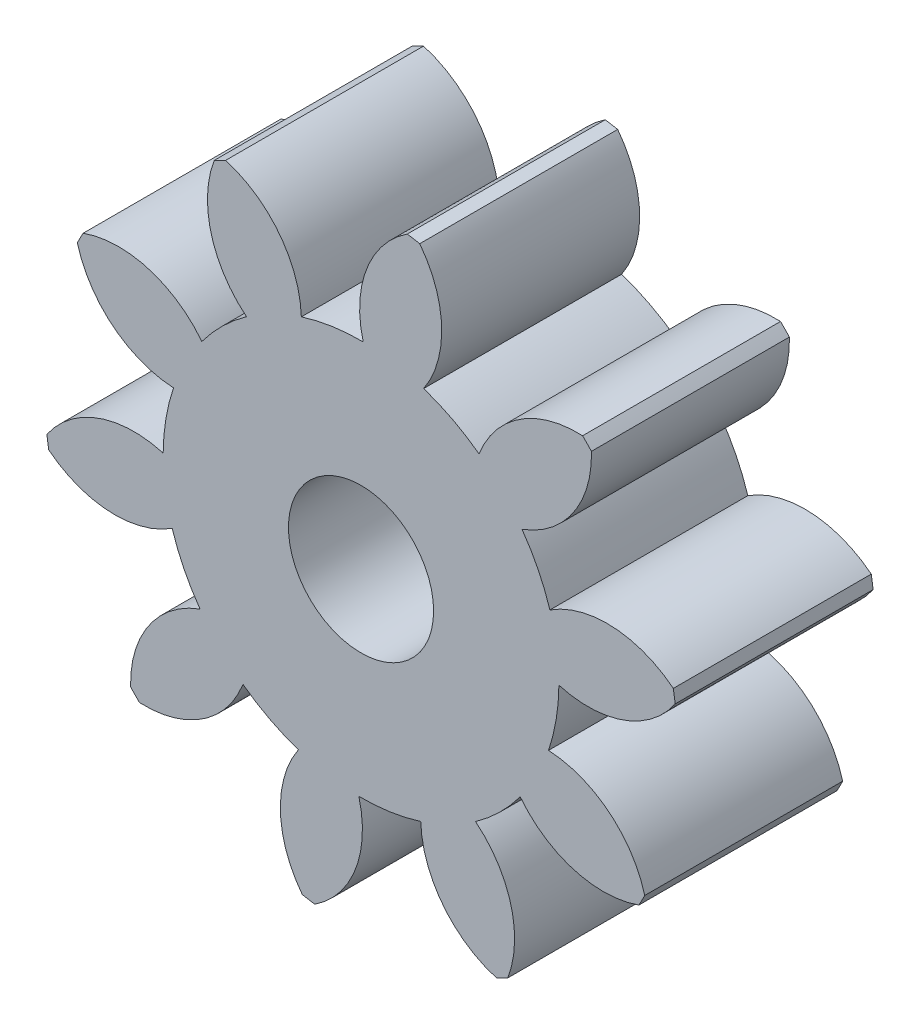
from build123d import *

# Parameters (mm, degrees)
SKETCH1_R           = 6
SKETCH1_R_2         = 1.1
BOSS_EXTRUDE1_DEPTH = 2.9
SKETCH2_R           = 6
CUT_EXTRUDE1_DEPTH  = 11.278132126
CUT_EXTRUDE2_DEPTH  = 2.8


with BuildPart() as part:
    # Sketch1 → Boss-Extrude1 (new, symmetric)
    with BuildSketch(Plane.XY):
        Circle(SKETCH1_R)
        Circle(SKETCH1_R_2, mode=Mode.SUBTRACT)
    extrude(amount=BOSS_EXTRUDE1_DEPTH, both=True)

    # Sketch2 → Cut-Extrude1 (cut, through all)
    with BuildSketch(Plane.XY.offset(2.9)):
        Circle(SKETCH2_R)
        with BuildLine():
            ThreePointArc((-0.904303163, 2.859411966), (-1.23929318, 3.784776039), (-2.052505646, 4.339034521))
            ThreePointArc((-2.052505646, 4.339034521), (-2.138842368, 4.297133152), (-2.224324134, 4.253514094))
            ThreePointArc((-2.224324134, 4.253514094), (-2.272407373, 3.270556831), (-1.736096974, 2.44539737))
            ThreePointArc((-1.736096974, 2.44539737), (-2.100579038, 2.140459929), (-2.412316811, 1.781776811))
            ThreePointArc((-2.412316811, 1.781776811), (-3.227244783, 2.333509881), (-4.210932449, 2.303920118))
            ThreePointArc((-4.210932449, 2.303920118), (-4.256151318, 2.219273746), (-4.29966888, 2.133740266))
            ThreePointArc((-4.29966888, 2.133740266), (-3.760801254, 1.310248516), (-2.841900466, 0.957915832))
            ThreePointArc((-2.841900466, 0.957915832), (-2.957534919, 0.496979078), (-2.998907428, 0.023563475))
            ThreePointArc((-2.998907428, 0.023563475), (-3.982498568, -0.009077739), (-4.760926181, -0.611213463))
            ThreePointArc((-4.760926181, -0.611213463), (-4.747755125, -0.706272801), (-4.732686255, -0.801049821))
            ThreePointArc((-4.732686255, -0.801049821), (-3.812696882, -1.150530198), (-2.862194572, -0.895456995))
            ThreePointArc((-2.862194572, -0.895456995), (-2.684812984, -1.336330888), (-2.440017337, -1.743650307))
            ThreePointArc((-2.440017337, -1.743650307), (-3.216573261, -2.348197971), (-3.49240793, -3.292884275))
            ThreePointArc((-3.49240793, -3.292884275), (-3.425877845, -3.362047143), (-3.357978338, -3.429866103))
            ThreePointArc((-3.357978338, -3.429866103), (-2.408271889, -3.171845481), (-1.789227635, -2.406795685))
            ThreePointArc((-1.789227635, -2.406795685), (-1.386583742, -2.659207876), (-0.949123556, -2.844848937))
            ThreePointArc((-0.949123556, -2.844848937), (-1.222026295, -3.79038639), (-0.889908552, -4.716785215))
            ThreePointArc((-0.889908552, -4.716785215), (-0.795431669, -4.733633748), (-0.700636829, -4.74859011))
            ThreePointArc((-0.700636829, -4.74859011), (-0.083968889, -3.981623598), (-0.032836554, -2.998820228))
            ThreePointArc((-0.032836554, -2.998820228), (0.44127336, -2.966357838), (0.904303163, -2.859411966))
            ThreePointArc((0.904303163, -2.859411966), (1.23929318, -3.784776039), (2.052505646, -4.339034521))
            ThreePointArc((2.052505646, -4.339034521), (2.138842368, -4.297133152), (2.224324134, -4.253514094))
            ThreePointArc((2.224324134, -4.253514094), (2.272407373, -3.270556831), (1.736096974, -2.44539737))
            ThreePointArc((1.736096974, -2.44539737), (2.100579038, -2.140459929), (2.412316811, -1.781776811))
            ThreePointArc((2.412316811, -1.781776811), (3.227244783, -2.333509881), (4.210932449, -2.303920118))
            ThreePointArc((4.210932449, -2.303920118), (4.256151318, -2.219273746), (4.29966888, -2.133740266))
            ThreePointArc((4.29966888, -2.133740266), (3.760801254, -1.310248516), (2.841900466, -0.957915832))
            ThreePointArc((2.841900466, -0.957915832), (2.957534919, -0.496979078), (2.998907428, -0.023563475))
            ThreePointArc((2.998907428, -0.023563475), (3.982498568, 0.009077739), (4.760926181, 0.611213463))
            ThreePointArc((4.760926181, 0.611213463), (4.747755125, 0.706272801), (4.732686255, 0.801049821))
            ThreePointArc((4.732686255, 0.801049821), (3.812696882, 1.150530198), (2.862194572, 0.895456995))
            ThreePointArc((2.862194572, 0.895456995), (2.684812984, 1.336330888), (2.440017337, 1.743650307))
            ThreePointArc((2.440017337, 1.743650307), (3.216573261, 2.348197971), (3.49240793, 3.292884275))
            ThreePointArc((3.49240793, 3.292884275), (3.425877845, 3.362047143), (3.357978338, 3.429866103))
            ThreePointArc((3.357978338, 3.429866103), (2.408271889, 3.171845481), (1.789227635, 2.406795685))
            ThreePointArc((1.789227635, 2.406795685), (1.386583742, 2.659207876), (0.949123556, 2.844848937))
            ThreePointArc((0.949123556, 2.844848937), (1.222026295, 3.79038639), (0.889908552, 4.716785215))
            ThreePointArc((0.889908552, 4.716785215), (0.795431669, 4.733633748), (0.700636829, 4.74859011))
            ThreePointArc((0.700636829, 4.74859011), (0.083968889, 3.981623598), (0.032836554, 2.998820228))
            ThreePointArc((0.032836554, 2.998820228), (-0.44127336, 2.966357838), (-0.904303163, 2.859411966))
        make_face(mode=Mode.SUBTRACT)
    extrude(amount=-CUT_EXTRUDE1_DEPTH, mode=Mode.SUBTRACT)

    # Sketch3 → Cut-Extrude2 (cut)
    with BuildSketch(Plane.XY.offset(2.9)):
        with BuildLine():
            ThreePointArc((0.700636829, 4.74859011), (0.083968889, 3.981623598), (0.032836554, 2.998820228))
            ThreePointArc((0.032836554, 2.998820228), (-0.44127336, 2.966357838), (-0.904303163, 2.859411966))
            ThreePointArc((-0.904303163, 2.859411966), (-1.23929318, 3.784776039), (-2.052505646, 4.339034521))
            ThreePointArc((-2.052505646, 4.339034521), (-2.138842368, 4.297133152), (-2.224324134, 4.253514094))
            ThreePointArc((-2.224324134, 4.253514094), (-2.272407373, 3.270556831), (-1.736096974, 2.44539737))
            ThreePointArc((-1.736096974, 2.44539737), (-2.100579038, 2.140459929), (-2.412316811, 1.781776811))
            ThreePointArc((-2.412316811, 1.781776811), (-3.227244783, 2.333509881), (-4.210932449, 2.303920118))
            ThreePointArc((-4.210932449, 2.303920118), (-4.256151318, 2.219273746), (-4.29966888, 2.133740266))
            ThreePointArc((-4.29966888, 2.133740266), (-3.760801254, 1.310248516), (-2.841900466, 0.957915832))
            ThreePointArc((-2.841900466, 0.957915832), (-2.957534919, 0.496979078), (-2.998907428, 0.023563475))
            ThreePointArc((-2.998907428, 0.023563475), (-3.982498568, -0.009077739), (-4.760926181, -0.611213463))
            ThreePointArc((-4.760926181, -0.611213463), (-4.747755125, -0.706272801), (-4.732686255, -0.801049821))
            ThreePointArc((-4.732686255, -0.801049821), (-3.812696882, -1.150530198), (-2.862194572, -0.895456995))
            ThreePointArc((-2.862194572, -0.895456995), (-2.684812984, -1.336330888), (-2.440017337, -1.743650307))
            ThreePointArc((-2.440017337, -1.743650307), (-3.216573261, -2.348197971), (-3.49240793, -3.292884275))
            ThreePointArc((-3.49240793, -3.292884275), (-3.425877845, -3.362047143), (-3.357978338, -3.429866103))
            ThreePointArc((-3.357978338, -3.429866103), (-2.408271889, -3.171845481), (-1.789227635, -2.406795685))
            ThreePointArc((-1.789227635, -2.406795685), (-1.386583742, -2.659207876), (-0.949123556, -2.844848937))
            ThreePointArc((-0.949123556, -2.844848937), (-1.222026295, -3.79038639), (-0.889908552, -4.716785215))
            ThreePointArc((-0.889908552, -4.716785215), (-0.795431669, -4.733633748), (-0.700636829, -4.74859011))
            ThreePointArc((-0.700636829, -4.74859011), (-0.083968889, -3.981623598), (-0.032836554, -2.998820228))
            ThreePointArc((-0.032836554, -2.998820228), (0.44127336, -2.966357838), (0.904303163, -2.859411966))
            ThreePointArc((0.904303163, -2.859411966), (1.23929318, -3.784776039), (2.052505646, -4.339034521))
            ThreePointArc((2.052505646, -4.339034521), (2.138842368, -4.297133152), (2.224324134, -4.253514094))
            ThreePointArc((2.224324134, -4.253514094), (2.272407373, -3.270556831), (1.736096974, -2.44539737))
            ThreePointArc((1.736096974, -2.44539737), (2.100579038, -2.140459929), (2.412316811, -1.781776811))
            ThreePointArc((2.412316811, -1.781776811), (3.227244783, -2.333509881), (4.210932449, -2.303920118))
            ThreePointArc((4.210932449, -2.303920118), (4.256151318, -2.219273746), (4.29966888, -2.133740266))
            ThreePointArc((4.29966888, -2.133740266), (3.760801254, -1.310248516), (2.841900466, -0.957915832))
            ThreePointArc((2.841900466, -0.957915832), (2.957534919, -0.496979078), (2.998907428, -0.023563475))
            ThreePointArc((2.998907428, -0.023563475), (3.982498568, 0.009077739), (4.760926181, 0.611213463))
            ThreePointArc((4.760926181, 0.611213463), (4.747755125, 0.706272801), (4.732686255, 0.801049821))
            ThreePointArc((4.732686255, 0.801049821), (3.812696882, 1.150530198), (2.862194572, 0.895456995))
            ThreePointArc((2.862194572, 0.895456995), (2.684812984, 1.336330888), (2.440017337, 1.743650307))
            ThreePointArc((2.440017337, 1.743650307), (3.216573261, 2.348197971), (3.49240793, 3.292884275))
            ThreePointArc((3.49240793, 3.292884275), (3.425877845, 3.362047143), (3.357978338, 3.429866103))
            ThreePointArc((3.357978338, 3.429866103), (2.408271889, 3.171845481), (1.789227635, 2.406795685))
            ThreePointArc((1.789227635, 2.406795685), (1.386583742, 2.659207876), (0.949123556, 2.844848937))
            ThreePointArc((0.949123556, 2.844848937), (1.222026295, 3.79038639), (0.889908552, 4.716785215))
            ThreePointArc((0.889908552, 4.716785215), (0.795431669, 4.733633748), (0.700636829, 4.74859011))
        make_face()
    extrude(amount=-CUT_EXTRUDE2_DEPTH, mode=Mode.SUBTRACT)


solid = part.part
